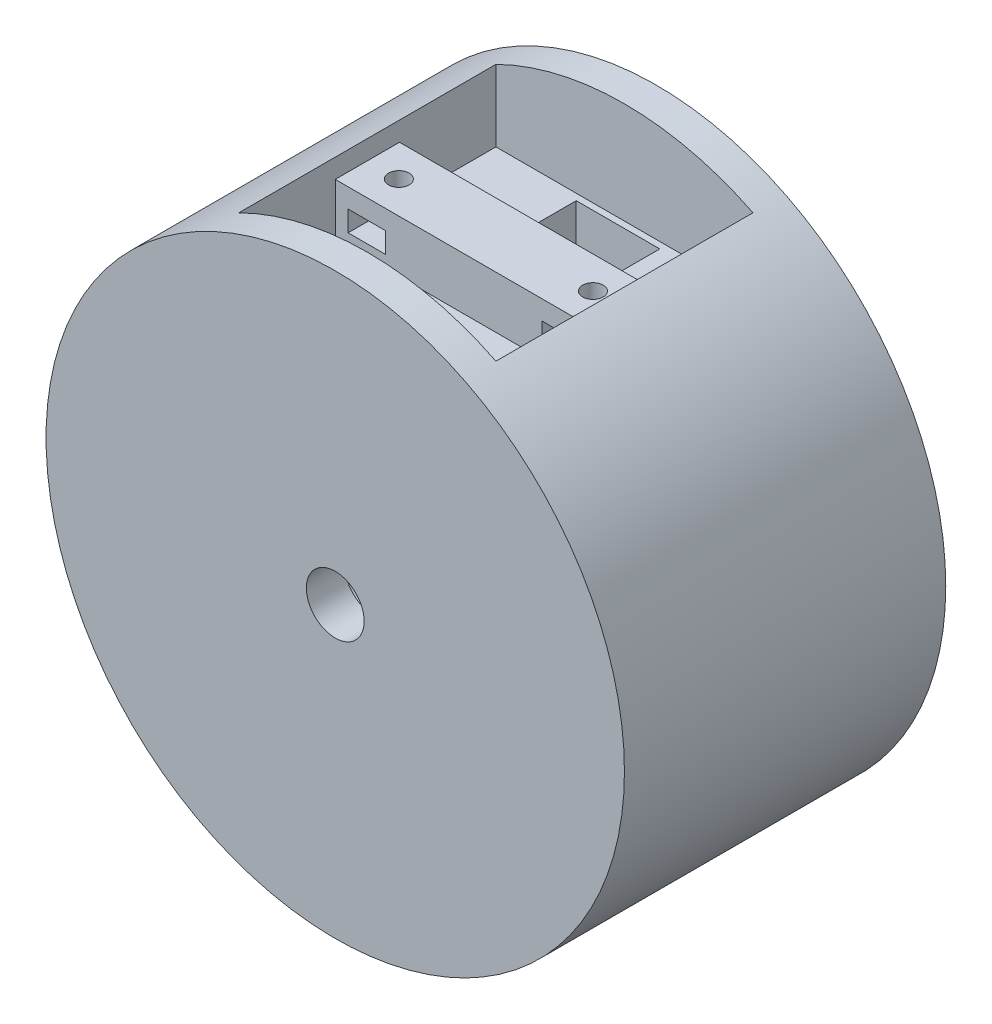
from build123d import *

# Parameters (mm, degrees)
ESBO_O1_R                = 45
RESSALTO_EXTRUS_O1_DEPTH = 50
ESBO_O2_R                = 4.5
CORTE_EXTRUS_O2_DEPTH    = 6
CORTE_EXTRUS_O3_DEPTH    = 7
ESBO_O4_W                = 40
ESBO_O4_H                = 15
CORTE_EXTRUS_O4_DEPTH    = 41
CORTE_EXTRUS_O5_START    = -6
ESBO_O5_R                = 4.5
CORTE_EXTRUS_O5_DEPTH    = 6
CORTE_EXTRUS_O6_START    = -7
CORTE_EXTRUS_O6_DEPTH    = 7
ESBO_O7_W                = 40
ESBO_O7_H                = 15
CORTE_EXTRUS_O7_DEPTH    = 47
CORTE_EXTRUS_O8_REACH    = 72.356
CORTE_EXTRUS_O9_REACH    = 72.356
ESBO_O9_W                = 5.8
ESBO_O9_H                = 3.2
ESBO_O11_W               = 40
ESBO_O11_H               = 15
ESBO_O11_W_2             = 13
ESBO_O11_H_2             = 7
RESSALTO_EXTRUS_O2_DEPTH = 22
ESBO_O12_R               = 1.6
CORTE_EXTRUS_O10_DEPTH   = 10
CORTE_EXTRUS_O11_REACH   = 75.614
ESBO_O13_R               = 4.5


with BuildPart() as part:
    # Esboço1 → Ressalto-extrusão1 (new body)
    with BuildSketch(Plane.XY):
        Circle(ESBO_O1_R)
    extrude(amount=RESSALTO_EXTRUS_O1_DEPTH)

    # Esboço2 → Corte-extrusão2 (cut)
    with BuildSketch(Plane.XY.offset(50)):
        Circle(ESBO_O2_R)
    extrude(amount=-CORTE_EXTRUS_O2_DEPTH, mode=Mode.SUBTRACT)

    # Esboço3 → Corte-extrusão3 (cut)
    with BuildSketch(Plane.XY.offset(44)):
        with BuildLine():
            Line((-6.5, -3.073450829), (-6.5, 7.19))
            Line((-6.5, 7.19), (6.5, 7.19))
            Line((6.5, 7.19), (6.5, -3.073450829))
            ThreePointArc((6.5, -3.073450829), (0, -7.19), (-6.5, -3.073450829))
        make_face()
    extrude(amount=-CORTE_EXTRUS_O3_DEPTH, mode=Mode.SUBTRACT)

    # Esboço4 → Corte-extrusão4 (cut)
    with BuildSketch(Plane.XZ.offset(-7.19)):
        with Locations((0, 37.5)):
            Rectangle(ESBO_O4_W, ESBO_O4_H)
    extrude(amount=-CORTE_EXTRUS_O4_DEPTH, mode=Mode.SUBTRACT)

    # Esboço5 → Corte-extrusão5 (cut)
    with BuildSketch(Plane(origin=(0, 0, 0), x_dir=(-1, 0, 0), z_dir=(0, 0, -1)).offset(CORTE_EXTRUS_O5_START)):
        with Locations(Location((0, 0, 0), (0, 0, 180))):
            Circle(ESBO_O5_R)
    extrude(amount=CORTE_EXTRUS_O5_DEPTH, mode=Mode.SUBTRACT)

    # Esboço6 → Corte-extrusão6 (cut)
    with BuildSketch(Plane(origin=(0, 0, 6), x_dir=(-1, 0, 0), z_dir=(0, 0, -1)).offset(CORTE_EXTRUS_O6_START)):
        with BuildLine():
            Line((-6.5, -3.073450829), (-6.5, 7.19))
            Line((-6.5, 7.19), (6.5, 7.19))
            Line((6.5, 7.19), (6.5, -3.073450829))
            ThreePointArc((6.5, -3.073450829), (0, -7.19), (-6.5, -3.073450829))
        make_face()
    extrude(amount=CORTE_EXTRUS_O6_DEPTH, mode=Mode.SUBTRACT)

    # Esboço7 → Corte-extrusão7 (cut)
    with BuildSketch(Plane.XZ.offset(-7.19)):
        with Locations((0, 12.5)):
            Rectangle(ESBO_O7_W, ESBO_O7_H)
    extrude(amount=-CORTE_EXTRUS_O7_DEPTH, mode=Mode.SUBTRACT)

    # Esboço8 → Corte-extrusão8 (cut, up to next)
    with BuildSketch(Plane.XY.offset(30), mode=Mode.PRIVATE) as corte_extrus_o8_sk1:
        Polygon((-20, 40.311288741), (-20, 47.3700993), (20, 47.3700993), (20, 40.311288741), (20, 37.311288741), (-20, 37.311288741), align=None)
    corte_extrus_o8_tool1 = extrude(corte_extrus_o8_sk1.sketch, amount=-CORTE_EXTRUS_O8_REACH, mode=Mode.PRIVATE) & part.part
    add(corte_extrus_o8_tool1.solids().sort_by_distance((0, 42.340694, 30))[0], mode=Mode.SUBTRACT)

    # Esboço9 → Corte-extrusão9 (cut, up to next)
    with BuildSketch(Plane(origin=(0, 0, 20), x_dir=(-1, 0, 0), z_dir=(0, 0, -1)), mode=Mode.PRIVATE) as corte_extrus_o9_sk1:
        with Locations((-15.1, 32.711288741)):
            Rectangle(ESBO_O9_W, ESBO_O9_H)
    corte_extrus_o9_tool1 = extrude(corte_extrus_o9_sk1.sketch, amount=-CORTE_EXTRUS_O9_REACH, mode=Mode.PRIVATE) & part.part
    # Esboço9 → Corte-extrusão9 (cut, up to next)
    with BuildSketch(Plane(origin=(0, 0, 20), x_dir=(-1, 0, 0), z_dir=(0, 0, -1)), mode=Mode.PRIVATE) as corte_extrus_o9_sk2:
        with Locations((15.1, 32.711288741)):
            Rectangle(ESBO_O9_W, ESBO_O9_H)
    corte_extrus_o9_tool2 = extrude(corte_extrus_o9_sk2.sketch, amount=-CORTE_EXTRUS_O9_REACH, mode=Mode.PRIVATE) & part.part
    add(corte_extrus_o9_tool1.solids().sort_by_distance((15.1, 32.711289, 20))[0], mode=Mode.SUBTRACT)
    add(corte_extrus_o9_tool2.solids().sort_by_distance((-15.1, 32.711289, 20))[0], mode=Mode.SUBTRACT)

    # Esboço11 → Ressalto-extrusão2 (add)
    # profile 1 of 2: a face of its own
    with BuildSketch(Plane(origin=(0, 7.19, 0), x_dir=(1, 0, 0), z_dir=(0, 1, 0))):
        with Locations((0, -12.5)):
            Rectangle(ESBO_O11_W, ESBO_O11_H)
        with Locations((0, -9.5)):
            Rectangle(ESBO_O11_W_2, ESBO_O11_H_2, mode=Mode.SUBTRACT)
    # profile 2 of 2: a face of its own
    with BuildSketch(Plane(origin=(0, 7.19, 0), x_dir=(1, 0, 0), z_dir=(0, 1, 0))):
        with Locations((0, -37.5)):
            Rectangle(ESBO_O11_W, ESBO_O11_H)
        with Locations((0, -40.5)):
            Rectangle(ESBO_O11_W_2, ESBO_O11_H_2, mode=Mode.SUBTRACT)
    extrude(amount=RESSALTO_EXTRUS_O2_DEPTH)

    # Esboço12 → Corte-extrusão10 (cut)
    with BuildSketch(Plane(origin=(0, 37.311288741, 0), x_dir=(1, 0, 0), z_dir=(0, 1, 0))):
        with Locations(Location((-15.1, -25, 0), (0, 0, 270))):
            Circle(ESBO_O12_R)
        with Locations(Location((15.1, -25, 0), (0, 0, 270))):
            Circle(ESBO_O12_R)
    extrude(amount=-CORTE_EXTRUS_O10_DEPTH, mode=Mode.SUBTRACT)

    # Esboço13 → Corte-extrusão11 (cut, up to next)
    with BuildSketch(Plane.XY.offset(37), mode=Mode.PRIVATE) as corte_extrus_o11_sk1:
        Circle(ESBO_O13_R)
    corte_extrus_o11_tool1 = extrude(corte_extrus_o11_sk1.sketch, amount=-CORTE_EXTRUS_O11_REACH, mode=Mode.PRIVATE) & part.part
    add(corte_extrus_o11_tool1.solids().sort_by_distance((0, 0, 37))[0], mode=Mode.SUBTRACT)


solid = part.part
